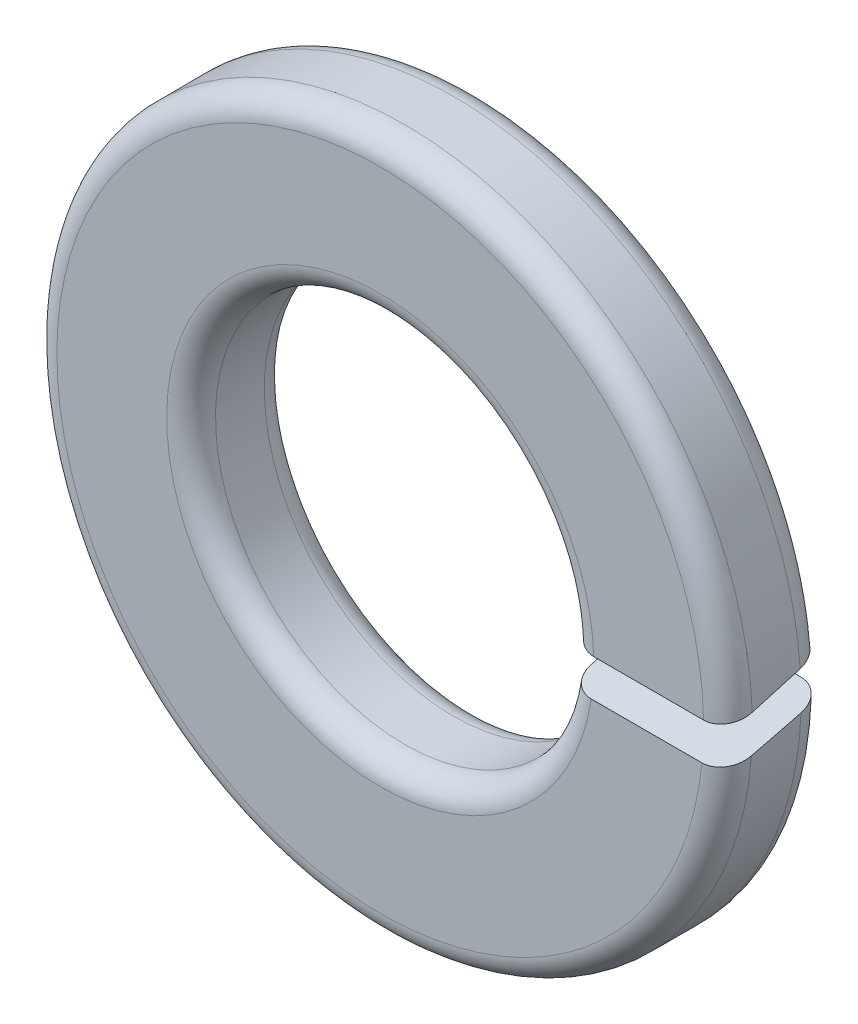
from build123d import *

# Parameters (mm, degrees)
SKICA1_R                 = 2.85
SKICA1_R_2               = 1.55
VYSUNOUT1_DEPTH          = 0.8
ZAOBLIT1_R               = 0.2
ODEBRAT_VYSUNUT_M1_DEPTH = 5.109136301


with BuildPart() as part:
    # Skica1 → Vysunout1 (new body)
    with BuildSketch(Plane.XY):
        Circle(SKICA1_R)
        Circle(SKICA1_R_2, mode=Mode.SUBTRACT)
    extrude(amount=VYSUNOUT1_DEPTH)

    # Zaoblit1
    zaoblit1_edges = [part.edges().sort_by_distance(p)[0] for p in [
        (-2.85, 0, 0),
        (-2.85, 0, 0.8),
        (-1.55, 0, 0),
        (-1.55, 0, 0.8),
    ]]
    fillet(zaoblit1_edges, radius=ZAOBLIT1_R)

    # Skica2 → Odebrat vysunutím1 (cut, through all)
    with BuildSketch(Plane(origin=(0, 0, 0), x_dir=(0, 0, -1), z_dir=(1, 0, 0))):
        Polygon((0, -0.04811175), (-0.8, -0.262471104), (-0.8, 0.04811175), (0, 0.262471104), align=None)
    extrude(amount=ODEBRAT_VYSUNUT_M1_DEPTH, mode=Mode.SUBTRACT)


solid = part.part
